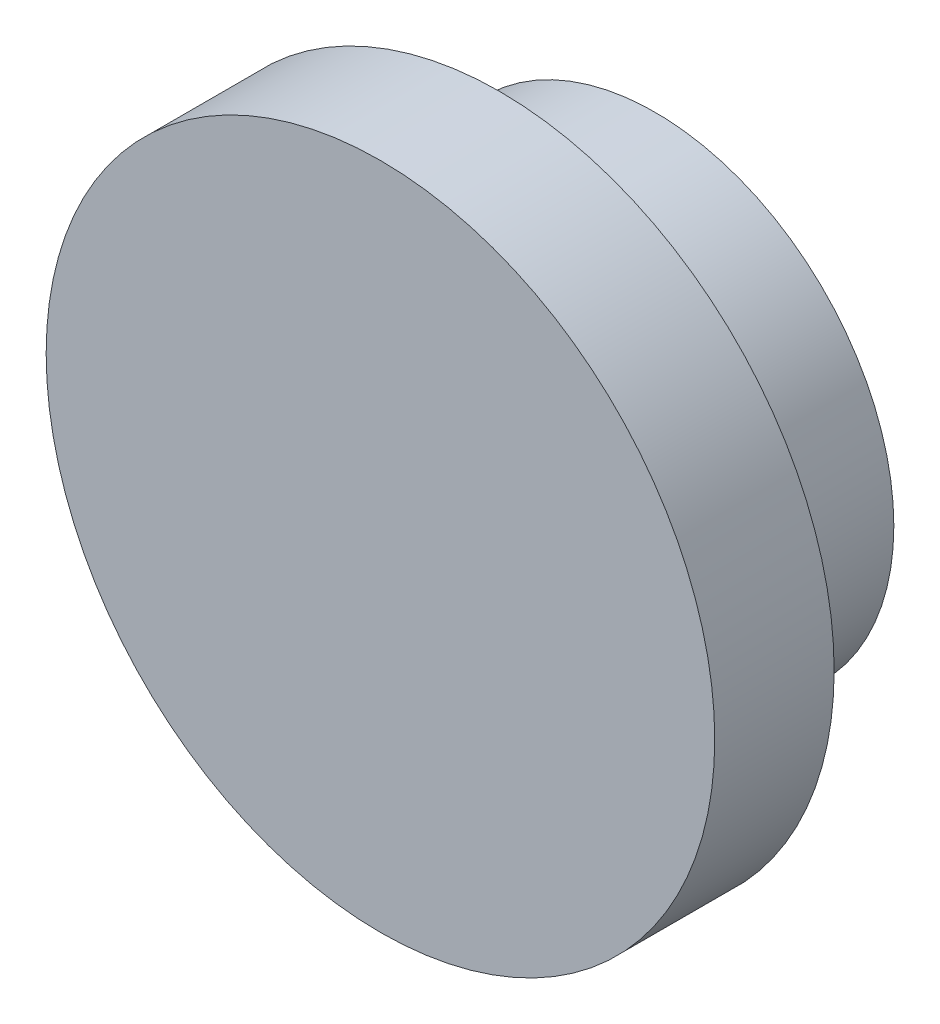
from build123d import *

# Parameters (mm, degrees)
SKETCH1_R           = 10
BOSS_EXTRUDE1_DEPTH = 6.5
SKETCH2_R           = 14
BOSS_EXTRUDE2_DEPTH = 5


with BuildPart() as part:
    # Sketch1 → Boss-Extrude1 (new body)
    with BuildSketch(Plane.XY):
        with Locations(Location((0, 0, 0), (0, 0, 180))):
            Circle(SKETCH1_R)
    extrude(amount=BOSS_EXTRUDE1_DEPTH)

    # Sketch2 → Boss-Extrude2 (add)
    with BuildSketch(Plane.XY.offset(6.5)):
        Circle(SKETCH2_R)
    extrude(amount=BOSS_EXTRUDE2_DEPTH)


solid = part.part
